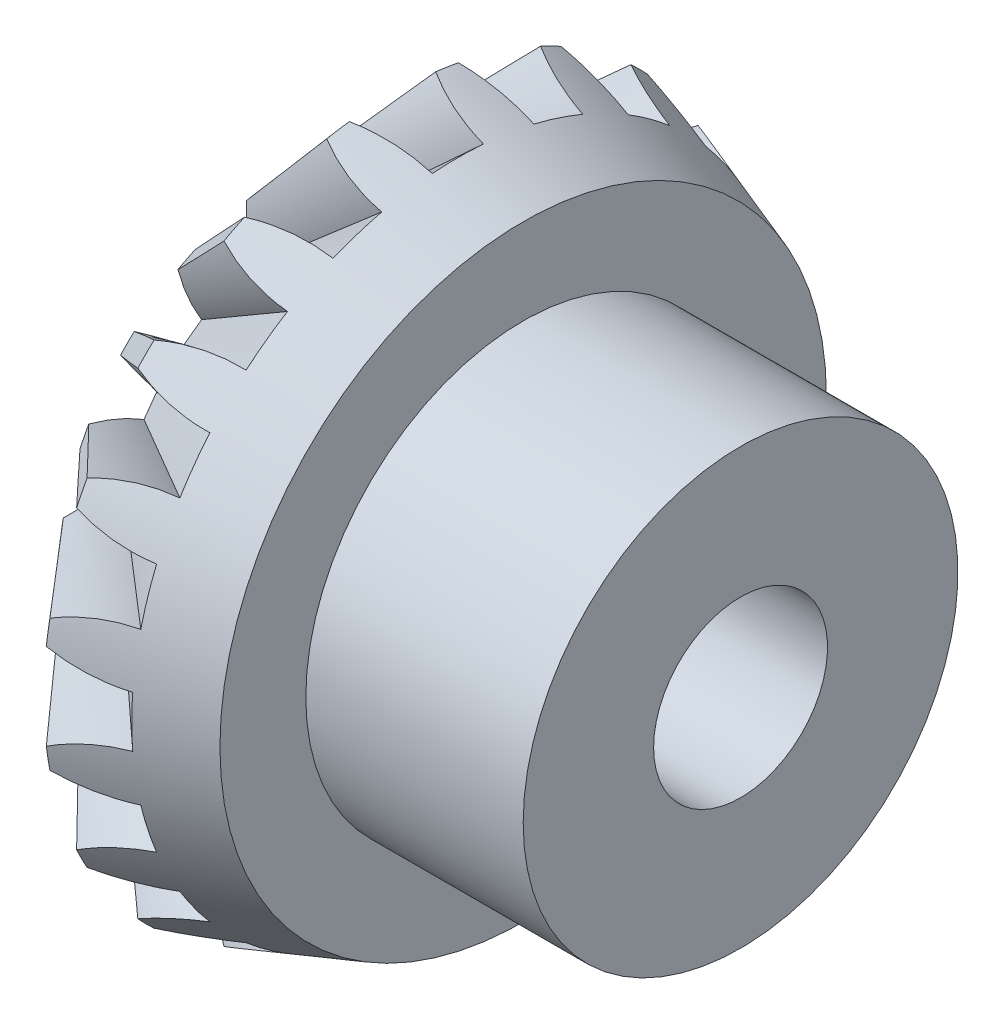
from build123d import *

# Parameters (mm, degrees)
CIRPATTERN1_COUNT = 20


with BuildPart() as part:
    # Sketch1 → Revolve1 (revolve)
    with BuildSketch(Plane.XY, mode=Mode.PRIVATE) as revolve1_sk:
        Polygon((0, 4), (20.6, 4), (20.6, 10), (10.6, 10), (10.6, 13.95), (4.591183676, 16.05), (0, 10.765964378), align=None)
    revolve(revolve1_sk.sketch.rotate(Axis((0, 0, 0), (1, 0, 0)), 90), axis=Axis((0, 0, 0), (1, 0, 0)))

    # Sketch6 for Cut-Loft1 → Cut-Loft1 section 0
    with BuildSketch(Plane(origin=(7.595591838, 0, 0), x_dir=(0, 0, -1), z_dir=(1, 0, 0))):
        with BuildLine():
            Line((-7.822441687, 24.075), (7.822441687, 24.075))
            # circular arc as an exact rational Bezier (weights 1, cos(half-angle), 1)
            Bezier((7.822441687, 24.075), (1.696547163, 21.556675594), (1.176886436, 14.953760006), weights=[1, 0.851943225, 1])
            Bezier((1.176886436, 14.953760006), (0, 15.046382977), (-1.176886436, 14.953760006), weights=[1, 0.996917334, 1])
            Bezier((-1.176886436, 14.953760006), (-1.696547163, 21.556675594), (-7.822441687, 24.075), weights=[1, 0.851943225, 1])
        make_face()
    # Sketch5 for Cut-Loft1 → Cut-Loft1 section 1
    with BuildSketch(Plane.ZY):
        with BuildLine():
            Line((-0.629634243, 8.000261603), (0.629634243, 8.000261603))
            Bezier((0.629634243, 8.000261603), (0.99969465, 12.702324901), (4.95972276, 15.264457087), weights=[1, 0.896497279, 1])
            Bezier((4.95972276, 15.264457087), (0, 16.875968699), (-4.95972276, 15.264457087), weights=[1, 0.951056516, 1])
            Bezier((-4.95972276, 15.264457087), (-0.99969465, 12.702324901), (-0.629634243, 8.000261603), weights=[1, 0.896497279, 1])
        make_face()
    cut_loft1 = loft(mode=Mode.SUBTRACT)

    # CirPattern1: Cut-Loft1 ×20 about axis
    cirpattern1_axis = Axis((0, 0, 0), (-1, 0, 0))
    for i in range(1, CIRPATTERN1_COUNT):
        add(cut_loft1.rotate(cirpattern1_axis, i * 360 / CIRPATTERN1_COUNT), mode=Mode.SUBTRACT)


solid = part.part
